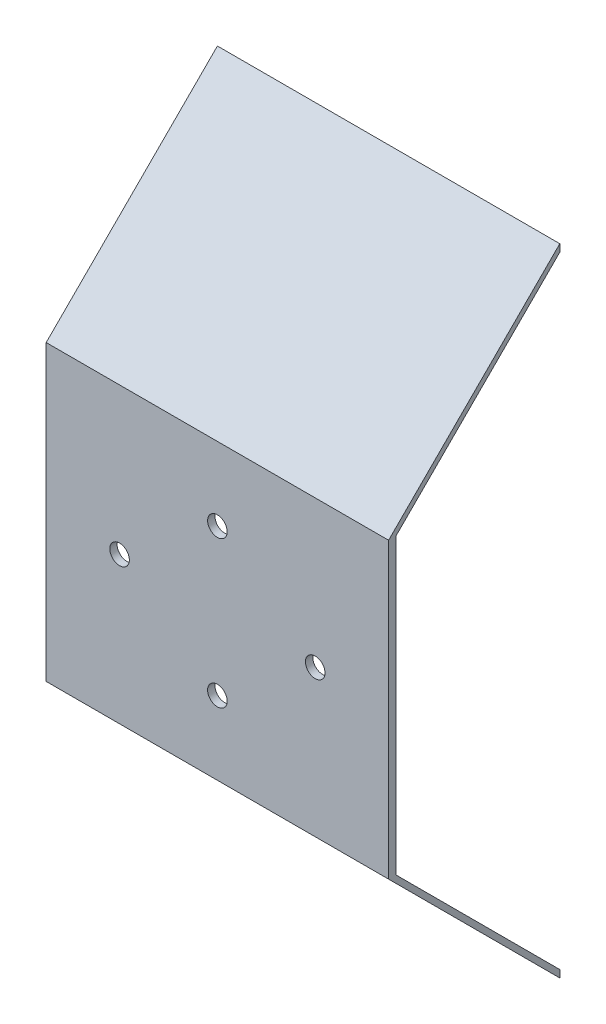
from build123d import *

# Parameters (mm, degrees)
BOSS_EXTRUDE1_DEPTH = 140
SKETCH2_R           = 4
CUT_EXTRUDE1_DEPTH  = 10


with BuildPart() as part:
    # Sketch1 → Boss-Extrude1 (new body)
    with BuildSketch(Plane.YZ):
        Polygon((60, 0), (-60, 0), (-127, -67), (-130, -67), (-60, 3), (60, 3), (130, -67), (127, -67), align=None)
    extrude(amount=BOSS_EXTRUDE1_DEPTH)

    # Sketch2 → Cut-Extrude1 (cut)
    with BuildSketch(Plane(origin=(0, 0, 0), x_dir=(1, 0, 0), z_dir=(0, 0, -1))):
        with Locations(Location((30, 0, 0), (0, 0, 270))):
            Circle(SKETCH2_R)
        with Locations(Location((110, 0, 0), (0, 0, 270))):
            Circle(SKETCH2_R)
        with Locations(Location((70, 30, 0), (0, 0, 270))):
            Circle(SKETCH2_R)
        with Locations(Location((70, -30, 0), (0, 0, 270))):
            Circle(SKETCH2_R)
    extrude(amount=-CUT_EXTRUDE1_DEPTH, mode=Mode.SUBTRACT)


solid = part.part
